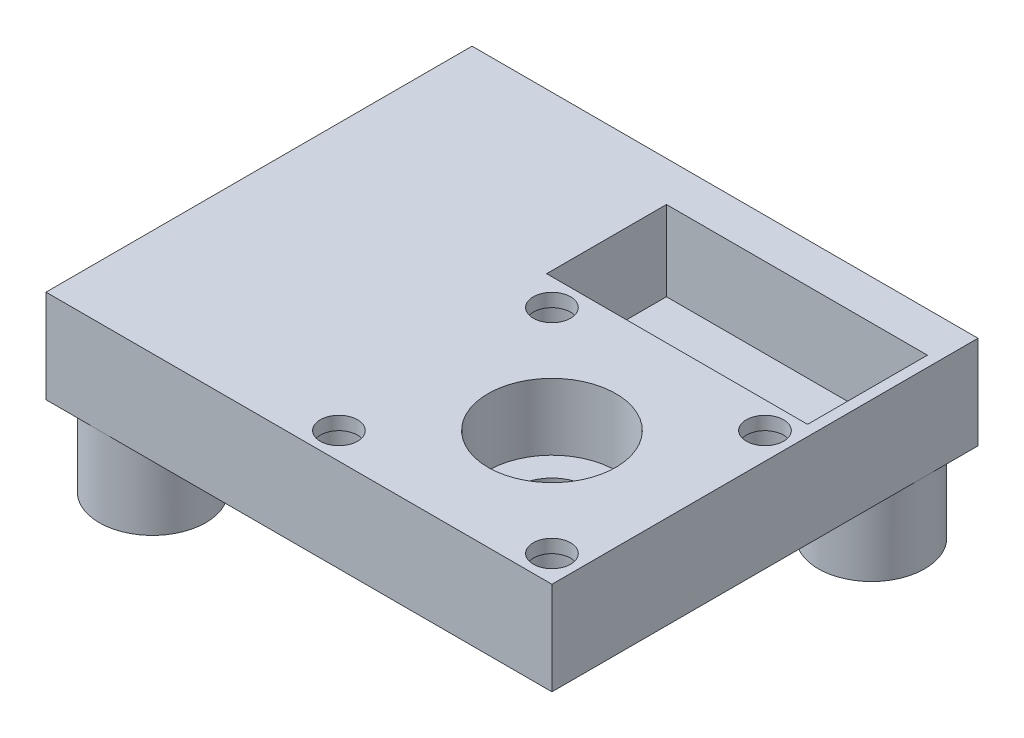
from build123d import *

# Parameters (mm, degrees)
SKETCH_1_W          = 19
SKETCH_1_H          = 16
EXTRUDE_1_DEPTH     = 3.5
SKETCH_1_3_R        = 1.35
CUT_EXTRUDE_1_DEPTH = 19.145247312
CUT_EXTRUDE_START   = 1
SKETCH_1_4_R        = 2.4
SKETCH_1_4_R_2      = 1.35
CUT_EXTRUDE_2_DEPTH = 2.5
SKETCH_1_7_R        = 0.7
CUT_EXTRUDE_3_DEPTH = 19.145247312
SKETCH_1_18_R       = 0.95
CUT_EXTRUDE_8_DEPTH = 3
SKETCH_1_17_R       = 1.25
CUT_EXTRUDE_4_DEPTH = 19.145247312
SKETCH_2_W          = 9.8
SKETCH_2_H          = 4.5
CUT_EXTRUDE_5_DEPTH = 3
SKETCH_4_R          = 1.05
CUT_EXTRUDE_6_DEPTH = 2.8
SKETCH_5_R          = 2
EXTRUDE_2_DEPTH     = 3
CUT_EXTRUDE_START_2 = 3
SKETCH_5_3_R        = 0.3
CUT_EXTRUDE_7_DEPTH = 1.5


with BuildPart() as part:
    # 草图1 → 凸台-拉伸1 (new body)
    with BuildSketch(Plane(origin=(0, 0, 0), x_dir=(1, 0, 0), z_dir=(0, 1, 0))):
        with Locations((-4.5, 3)):
            Rectangle(SKETCH_1_W, SKETCH_1_H)
    extrude(amount=EXTRUDE_1_DEPTH)

    # 草图1<3> → 切除-拉伸1 (cut, through all)
    with BuildSketch(Plane(origin=(0, 0, 0), x_dir=(1, 0, 0), z_dir=(0, 1, 0))):
        with Locations(Location((0, 0, 0), (0, 0, 270))):
            Circle(SKETCH_1_3_R)
    extrude(amount=CUT_EXTRUDE_1_DEPTH, mode=Mode.SUBTRACT)

    # 草图1<4> → 切除-拉伸2 (cut)
    with BuildSketch(Plane(origin=(0, 0, 0), x_dir=(1, 0, 0), z_dir=(0, 1, 0)).offset(CUT_EXTRUDE_START)):
        with Locations(Location((0, 0, 0), (0, 0, 270))):
            Circle(SKETCH_1_4_R)
        with Locations(Location((0, 0, 0), (0, 0, 270))):
            Circle(SKETCH_1_4_R_2, mode=Mode.SUBTRACT)
    extrude(amount=CUT_EXTRUDE_2_DEPTH, mode=Mode.SUBTRACT)

    # 草图1<7> → 切除-拉伸3 (cut, through all)
    with BuildSketch(Plane(origin=(0, 0, 0), x_dir=(1, 0, 0), z_dir=(0, 1, 0))):
        with Locations(Location((4, 4, 0), (0, 0, 270))):
            Circle(SKETCH_1_7_R)
        with Locations(Location((-4, -4, 0), (0, 0, 270))):
            Circle(SKETCH_1_7_R)
        with Locations(Location((-4, 4, 0), (0, 0, 270))):
            Circle(SKETCH_1_7_R)
        with Locations(Location((4, -4, 0), (0, 0, 270))):
            Circle(SKETCH_1_7_R)
    extrude(amount=CUT_EXTRUDE_3_DEPTH, mode=Mode.SUBTRACT)

    # 草图1<18> → 切除-拉伸8 (cut)
    with BuildSketch(Plane(origin=(0, 0, 0), x_dir=(1, 0, 0), z_dir=(0, 1, 0))):
        with Locations(Location((4, 4, 0), (0, 0, 270))):
            Circle(SKETCH_1_18_R)
        with Locations(Location((-4, -4, 0), (0, 0, 270))):
            Circle(SKETCH_1_18_R)
        with Locations(Location((-4, 4, 0), (0, 0, 270))):
            Circle(SKETCH_1_18_R)
        with Locations(Location((4, -4, 0), (0, 0, 270))):
            Circle(SKETCH_1_18_R)
    extrude(amount=CUT_EXTRUDE_8_DEPTH, mode=Mode.SUBTRACT)

    # 草图1<17> → 切除-拉伸4 (cut, through all)
    with BuildSketch(Plane(origin=(0, 0, 0), x_dir=(1, 0, 0), z_dir=(0, 1, 0))):
        with Locations(Location((-3.9, 6.4, 0), (0, 0, 270))):
            Circle(SKETCH_1_17_R)
    extrude(amount=CUT_EXTRUDE_4_DEPTH, mode=Mode.SUBTRACT)

    # 草图2 → 切除-拉伸5 (cut)
    with BuildSketch(Plane(origin=(0, 3.5, 0), x_dir=(1, 0, 0), z_dir=(0, 1, 0))):
        with Locations((-0.3, 7.25)):
            Rectangle(SKETCH_2_W, SKETCH_2_H)
    extrude(amount=-CUT_EXTRUDE_5_DEPTH, mode=Mode.SUBTRACT)

    # 草图4 → 切除-拉伸6 (cut)
    with BuildSketch(Plane.XZ):
        with Locations(Location((-8.107149516, -2.554237014, 0), (0, 0, 270))):
            Circle(SKETCH_4_R)
    extrude(amount=-CUT_EXTRUDE_6_DEPTH, mode=Mode.SUBTRACT)

    # 草图5 → 凸台-拉伸2 (add)
    with BuildSketch(Plane.XZ):
        with Locations(Location((-12, 3, 0), (0, 0, 90))):
            Circle(SKETCH_5_R)
        with Locations(Location((-12, -9, 0), (0, 0, 270))):
            Circle(SKETCH_5_R)
        with Locations(Location((3, -9, 0), (0, 0, 270))):
            Circle(SKETCH_5_R)
    extrude(amount=EXTRUDE_2_DEPTH)

    # 草图5<3> → 切除-拉伸7 (cut)
    with BuildSketch(Plane.XZ.offset(CUT_EXTRUDE_START_2)):
        with Locations(Location((3, -9, 0), (0, 0, 270))):
            Circle(SKETCH_5_3_R)
        with Locations(Location((-12, -9, 0), (0, 0, 270))):
            Circle(SKETCH_5_3_R)
        with Locations(Location((-12, 3, 0), (0, 0, 270))):
            Circle(SKETCH_5_3_R)
    extrude(amount=-CUT_EXTRUDE_7_DEPTH, mode=Mode.SUBTRACT)


solid = part.part
